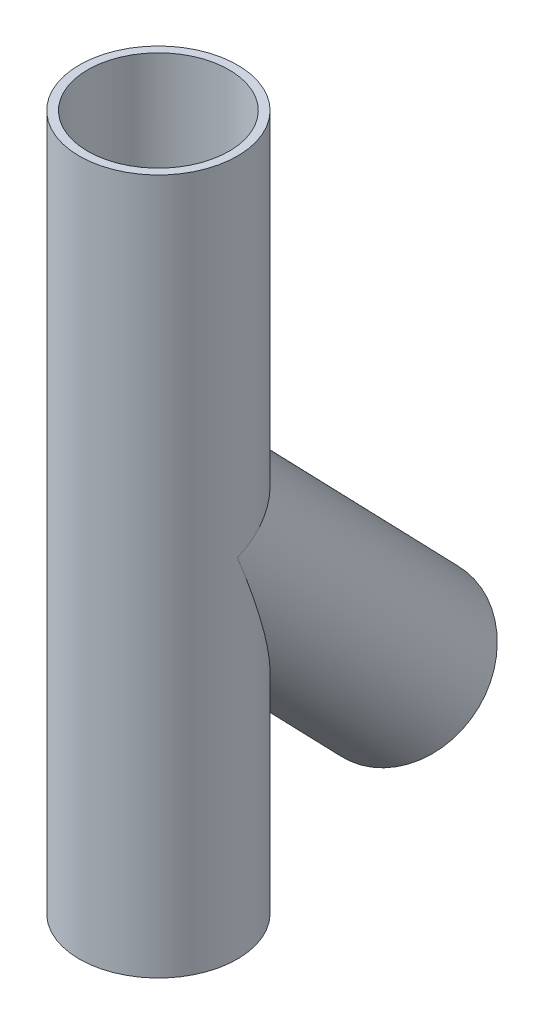
from build123d import *

# Parameters (mm, degrees)
SALIENTE_EXTRUIR1_DEPTH      = 125
SALIENTE_EXTRUIR1_DEPTH_BACK = 125
CROQUIS1_R                   = 28.4
CROQUIS1_R_2                 = 25.4
CROQUIS4_R                   = 28.4
CROQUIS4_R_2                 = 25.4
SALIENTE_EXTRUIR3_DEPTH      = 125


with BuildPart() as part:
    # Croquis1 → Saliente-Extruir1 (new, two sides: drawn at the far end of the back side and taken through both)
    with BuildSketch(Plane(origin=(0, 0, 0), x_dir=(1, 0, 0), z_dir=(0, 1, 0)).offset(-SALIENTE_EXTRUIR1_DEPTH_BACK)):
        Circle(CROQUIS1_R)
        Circle(CROQUIS1_R_2, mode=Mode.SUBTRACT)
    extrude(amount=SALIENTE_EXTRUIR1_DEPTH + SALIENTE_EXTRUIR1_DEPTH_BACK)

    # Croquis4 → Saliente-Extruir3 (add)
    with BuildSketch(Plane(origin=(0, 0, 0), x_dir=(0, 0.6946583704589961, -0.7193398003386523), z_dir=(0, -0.7193398003386523, -0.6946583704589961))):
        Circle(CROQUIS4_R)
        Circle(CROQUIS4_R_2, mode=Mode.SUBTRACT)
    extrude(amount=SALIENTE_EXTRUIR3_DEPTH)


solid = part.part
